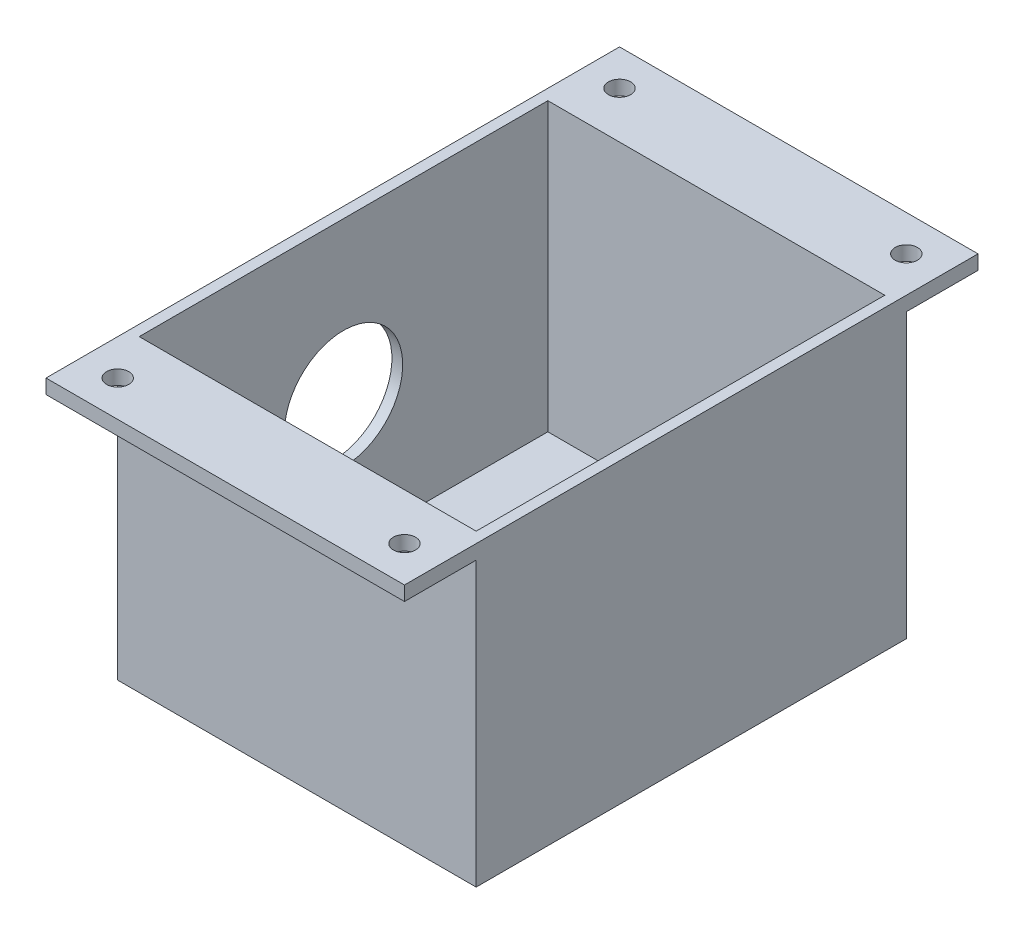
from build123d import *

# Parameters (mm, degrees)
SKETCH1_W           = 50
SKETCH1_H           = 60
SKETCH1_W_2         = 47
SKETCH1_H_2         = 57
BOSS_EXTRUDE6_DEPTH = 40
SKETCH7_W           = 50
SKETCH7_H           = 60
BOSS_EXTRUDE8_DEPTH = 1.5
SKETCH8_W           = 10
SKETCH8_H           = 2
BOSS_EXTRUDE9_DEPTH = 50
SKETCH9_R           = 1.55
CUT_EXTRUDE1_DEPTH  = 3
SKETCH11_R          = 8.25
CUT_EXTRUDE3_DEPTH  = 1.5


with BuildPart() as part:
    # Sketch1 → Boss-Extrude6 (new body)
    with BuildSketch(Plane(origin=(0, 0, 0), x_dir=(1, 0, 0), z_dir=(0, 1, 0))):
        Rectangle(SKETCH1_W, SKETCH1_H)
        Rectangle(SKETCH1_W_2, SKETCH1_H_2, mode=Mode.SUBTRACT)
    extrude(amount=BOSS_EXTRUDE6_DEPTH)

    # Sketch7 → Boss-Extrude8 (add)
    with BuildSketch(Plane.XZ):
        Rectangle(SKETCH7_W, SKETCH7_H)
    extrude(amount=BOSS_EXTRUDE8_DEPTH)

    # Sketch8 → Boss-Extrude9 (add)
    with BuildSketch(Plane(origin=(25, 0, 0), x_dir=(0, 0, -1), z_dir=(1, 0, 0))):
        with Locations((-35, 39)):
            Rectangle(SKETCH8_W, SKETCH8_H)
        with Locations((35, 39)):
            Rectangle(SKETCH8_W, SKETCH8_H)
    extrude(amount=-BOSS_EXTRUDE9_DEPTH)

    # Sketch9 → Cut-Extrude1 (cut)
    with BuildSketch(Plane(origin=(0, 40, 0), x_dir=(1, 0, 0), z_dir=(0, 1, 0))):
        with Locations(Location((-20, 35, 0), (0, 0, 270))):
            Circle(SKETCH9_R)
        with Locations(Location((20, 35, 0), (0, 0, 270))):
            Circle(SKETCH9_R)
        with Locations(Location((20, -35, 0), (0, 0, 270))):
            Circle(SKETCH9_R)
        with Locations(Location((-20, -35, 0), (0, 0, 270))):
            Circle(SKETCH9_R)
    extrude(amount=-CUT_EXTRUDE1_DEPTH, mode=Mode.SUBTRACT)

    # Sketch11 → Cut-Extrude3 (cut)
    with BuildSketch(Plane.ZY.offset(25)):
        with Locations((0, 18.25)):
            Circle(SKETCH11_R)
    extrude(amount=-CUT_EXTRUDE3_DEPTH, mode=Mode.SUBTRACT)


solid = part.part
